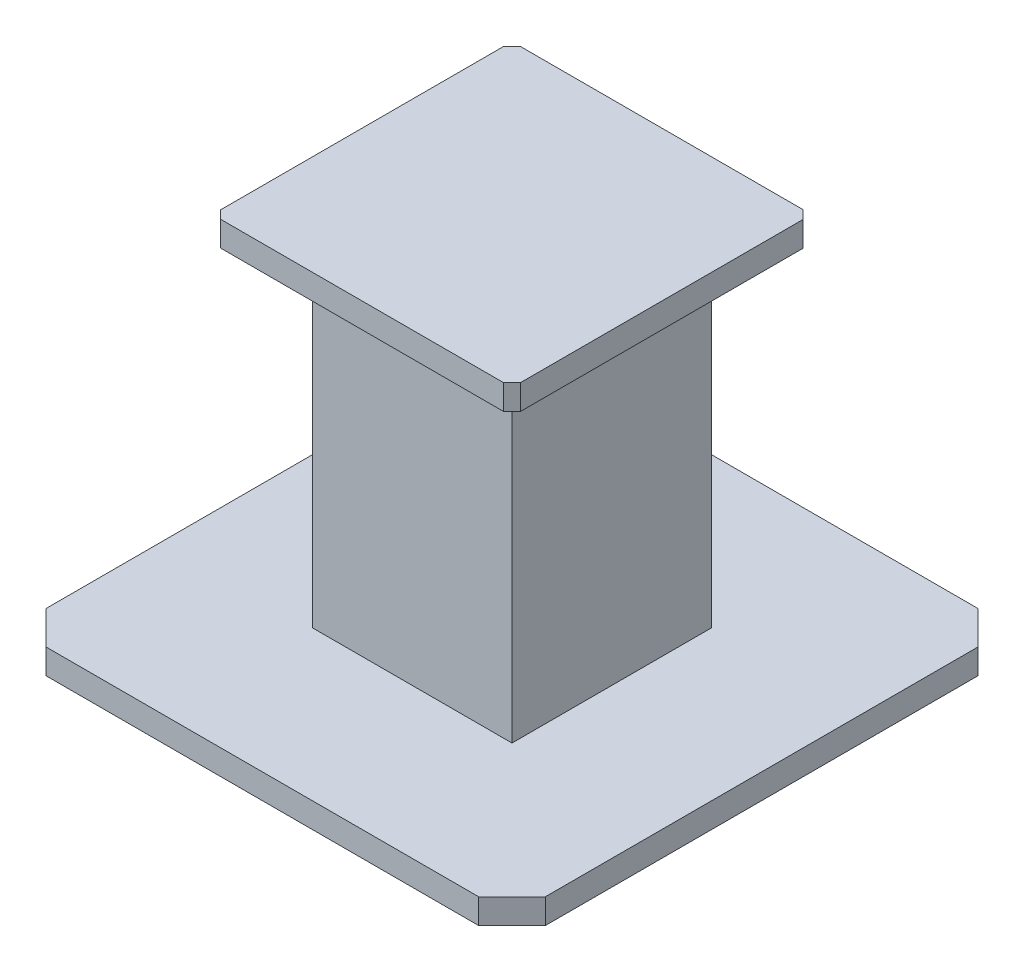
from build123d import *

# Parameters (mm, degrees)
SKETCH_1_W      = 180
SKETCH_1_H      = 180
EXTRUDE_1_DEPTH = 15
SKETCH_2_W      = 120
SKETCH_2_H      = 120
EXTRUDE_2_DEPTH = 200
SKETCH_3_W      = 300
SKETCH_3_H      = 300
EXTRUDE_3_DEPTH = 15
CHAMFER_1_SIZE  = 20
CHAMFER_2_SIZE  = 5


with BuildPart() as part:
    # 草图1 → 凸台-拉伸1 (new body)
    with BuildSketch(Plane(origin=(0, 0, 0), x_dir=(1, 0, 0), z_dir=(0, 1, 0))):
        Rectangle(SKETCH_1_W, SKETCH_1_H)
    extrude(amount=EXTRUDE_1_DEPTH)

    # 草图2 → 凸台-拉伸2 (add)
    with BuildSketch(Plane.XZ):
        Rectangle(SKETCH_2_W, SKETCH_2_H)
    extrude(amount=EXTRUDE_2_DEPTH)

    # 草图3 → 凸台-拉伸3 (add)
    with BuildSketch(Plane.XZ.offset(200)):
        Rectangle(SKETCH_3_W, SKETCH_3_H)
    extrude(amount=EXTRUDE_3_DEPTH)

    # 倒角1
    chamfer_1_edges = [part.edges().sort_by_distance(p)[0] for p in [
        (-150, -207.5, 150),
        (-150, -207.5, -150),
        (150, -207.5, -150),
        (150, -207.5, 150),
    ]]
    chamfer(chamfer_1_edges, length=CHAMFER_1_SIZE)

    # 倒角2
    chamfer_2_edges = [part.edges().sort_by_distance(p)[0] for p in [
        (-90, 7.5, -90),
        (90, 7.5, -90),
        (90, 7.5, 90),
        (-90, 7.5, 90),
    ]]
    chamfer(chamfer_2_edges, length=CHAMFER_2_SIZE)


solid = part.part
